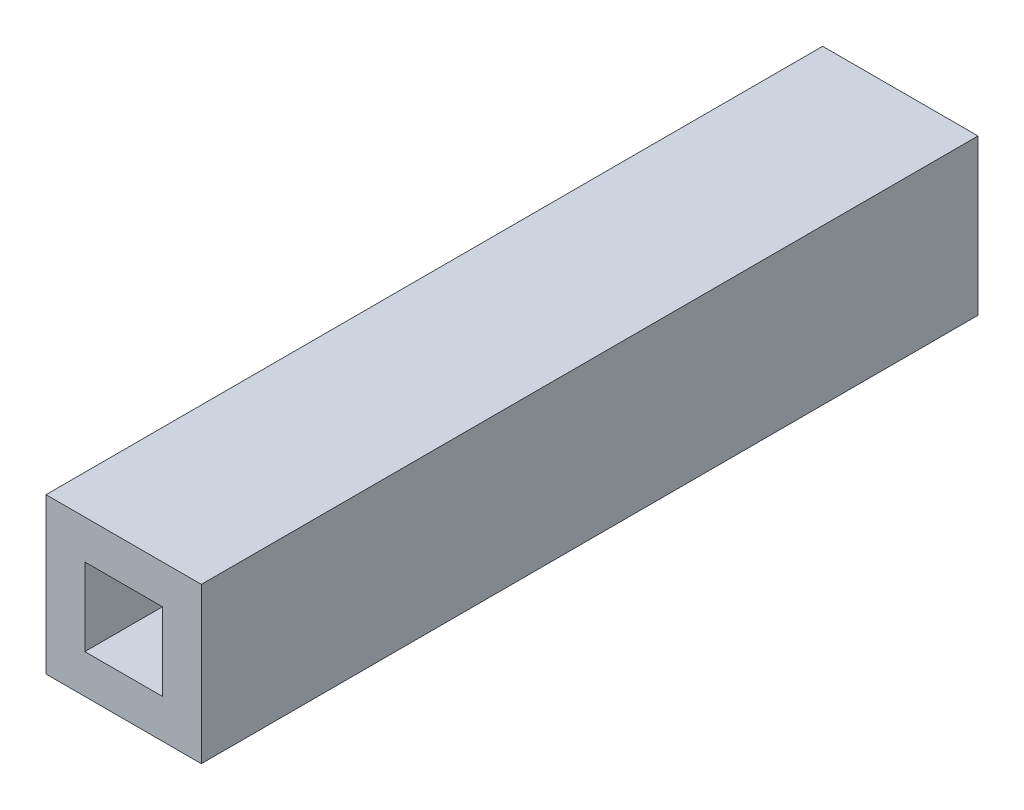
from build123d import *

# Parameters (mm, degrees)
SKETCH1_W           = 20
SKETCH1_H           = 20
SKETCH1_W_2         = 10
SKETCH1_H_2         = 10
EXTRUDE_THIN1_DEPTH = 100


with BuildPart() as part:
    # Sketch1 → Extrude-Thin1 (new body)
    with BuildSketch(Plane.XY):
        Rectangle(SKETCH1_W, SKETCH1_H)
        Rectangle(SKETCH1_W_2, SKETCH1_H_2, mode=Mode.SUBTRACT)
    extrude(amount=EXTRUDE_THIN1_DEPTH)


solid = part.part
